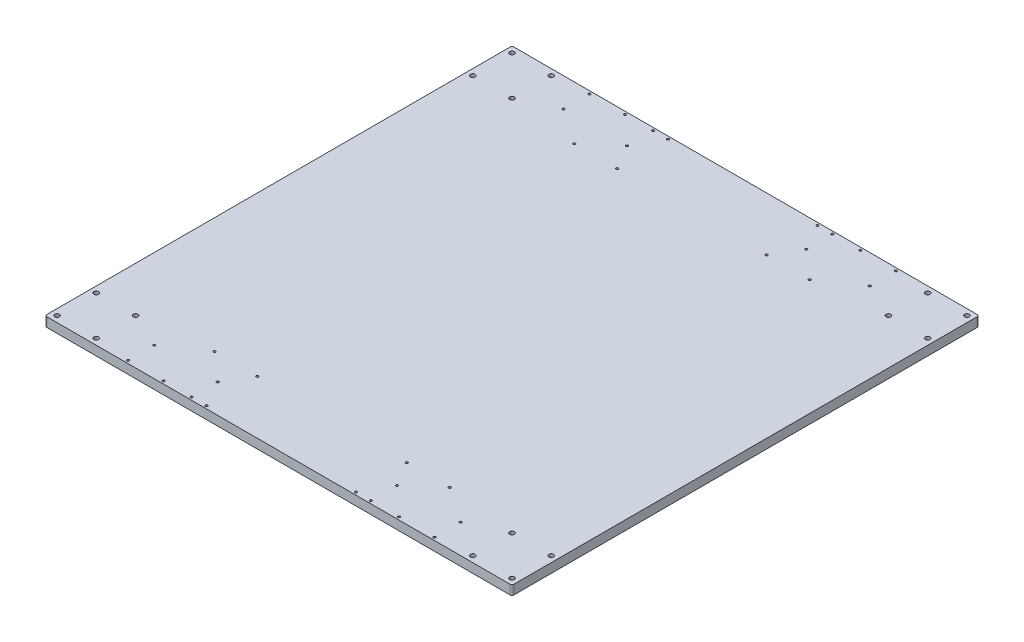
from build123d import *

# Parameters (mm, degrees)
SKETCH1_W                   = 500
SKETCH1_H                   = 500
BOSS_EXTRUDE1_DEPTH         = 10
TAP_DRILL_FOR_M3X0_5_TAP1_D = 2.5
TAP_DRILL_FOR_M6X1_0_TAP1_D = 5
CIRPATTERN1_COUNT           = 4
FILLET1_R                   = 2


with BuildPart() as part:
    # Sketch1 → Boss-Extrude1 (new body)
    with BuildSketch(Plane(origin=(0, 0, 0), x_dir=(1, 0, 0), z_dir=(0, 1, 0))):
        Rectangle(SKETCH1_W, SKETCH1_H)
    extrude(amount=BOSS_EXTRUDE1_DEPTH)

    # Tap Drill for M3x0.5 Tap1 (through all)
    with Locations(Plane(origin=(0, 10, 0), x_dir=(1, 0, 0), z_dir=(0, 1, 0))):
        with Locations((164, -219), (164, -247), (96, -247), (96, -219), (-96, -219), (-164, -219), (-164, -247), (-96, -247), (-96, 219), (-96, 247), (-164, 247), (-164, 219), (96, 247), (164, 247), (164, 219), (96, 219), (-126, 247), (-80, 247), (-80, 192.6), (-126, 192.6), (80, 247), (126, 247), (126, 192.6), (80, 192.6), (80, -192.6), (126, -192.6), (126, -247), (80, -247), (-126, -192.6), (-80, -192.6), (-80, -247), (-126, -247)):
            Hole(TAP_DRILL_FOR_M3X0_5_TAP1_D / 2)

    # Tap Drill for M6x1.0 Tap1 (through all)
    with Locations(Plane(origin=(0, 10, 0), x_dir=(1, 0, 0), z_dir=(0, 1, 0))):
        with Locations((243.5, -243.5), (201.5, -201.5), (243.5, -201.5), (201.5, -243.5)):
            tap_drill_for_m6x1_0_tap1 = Hole(TAP_DRILL_FOR_M6X1_0_TAP1_D / 2)

    # CirPattern1: Tap Drill for M6x1.0 Tap1 ×4 about axis
    cirpattern1_axis = Axis((0, 10.5, 0), (0, -1, 0))
    for i in range(1, CIRPATTERN1_COUNT):
        add(tap_drill_for_m6x1_0_tap1.rotate(cirpattern1_axis, i * 360 / CIRPATTERN1_COUNT), mode=Mode.SUBTRACT)

    # Fillet1
    fillet1_edges = [part.edges().sort_by_distance(p)[0] for p in [
        (250, 5, -250),
        (250, 5, 250),
        (-250, 5, 250),
        (-250, 5, -250),
    ]]
    fillet(fillet1_edges, radius=FILLET1_R)


solid = part.part
